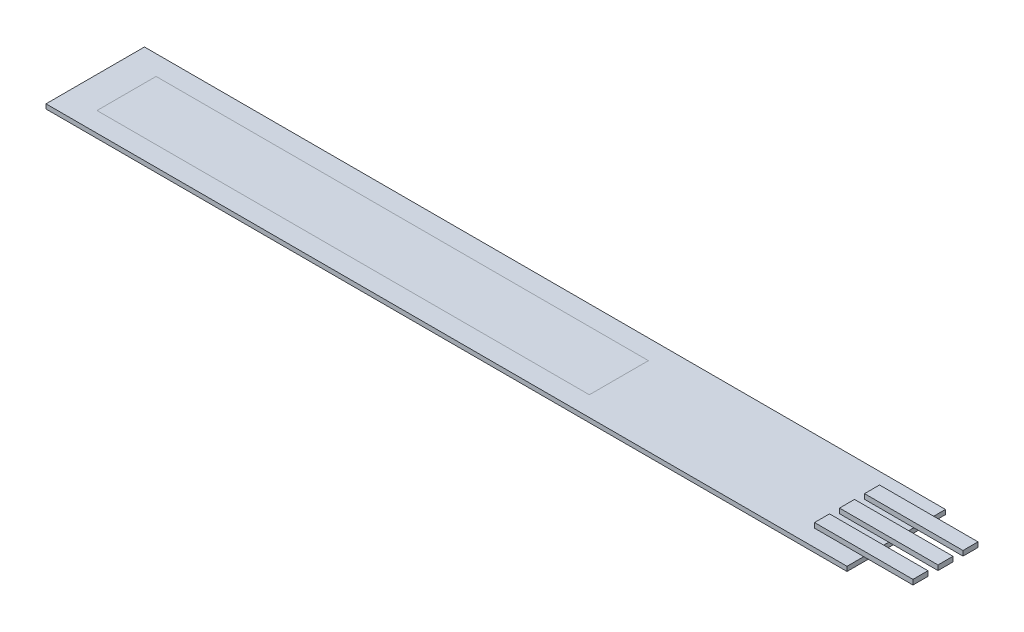
from build123d import *

# Parameters (mm, degrees)
SKETCH1_W           = 50
SKETCH1_H           = 6
BOSS_EXTRUDE1_DEPTH = 0.46
SKETCH2_W           = 50
SKETCH2_H           = 6
BOSS_EXTRUDE2_DEPTH = 0.46
SKETCH3_W           = 10
SKETCH3_H           = 1.52217223
BOSS_EXTRUDE3_DEPTH = 0.5


with BuildPart() as part:
    # Sketch1 → Boss-Extrude1 (new body)
    with BuildSketch(Plane(origin=(0, 0, 0), x_dir=(1, 0, 0), z_dir=(0, 1, 0))):
        Polygon((0, 5), (56.35, 5), (81.35, 5), (81.35, -5), (56.35, -5), (0, -5), align=None)
        with Locations((28.18, 0)):
            Rectangle(SKETCH1_W, SKETCH1_H, mode=Mode.SUBTRACT)
    extrude(amount=BOSS_EXTRUDE1_DEPTH)

    # Sketch3 → Boss-Extrude3 (add)
    with BuildSketch(Plane(origin=(0, 0.46, 0), x_dir=(1, 0, 0), z_dir=(0, 1, 0))):
        with Locations((81.35, 2.54)):
            Rectangle(SKETCH3_W, SKETCH3_H)
        with Locations((81.35, 0)):
            Rectangle(SKETCH3_W, SKETCH3_H)
        with Locations((81.35, -2.54)):
            Rectangle(SKETCH3_W, SKETCH3_H)
    extrude(amount=BOSS_EXTRUDE3_DEPTH)


with BuildPart() as body_2:
    # Sketch2 → Boss-Extrude2 (new body)
    with BuildSketch(Plane(origin=(0, 0.46, 0), x_dir=(1, 0, 0), z_dir=(0, 1, 0))):
        with Locations((28.18, 0)):
            Rectangle(SKETCH2_W, SKETCH2_H)
    extrude(amount=-BOSS_EXTRUDE2_DEPTH)


solid = Compound([part.part, body_2.part])
